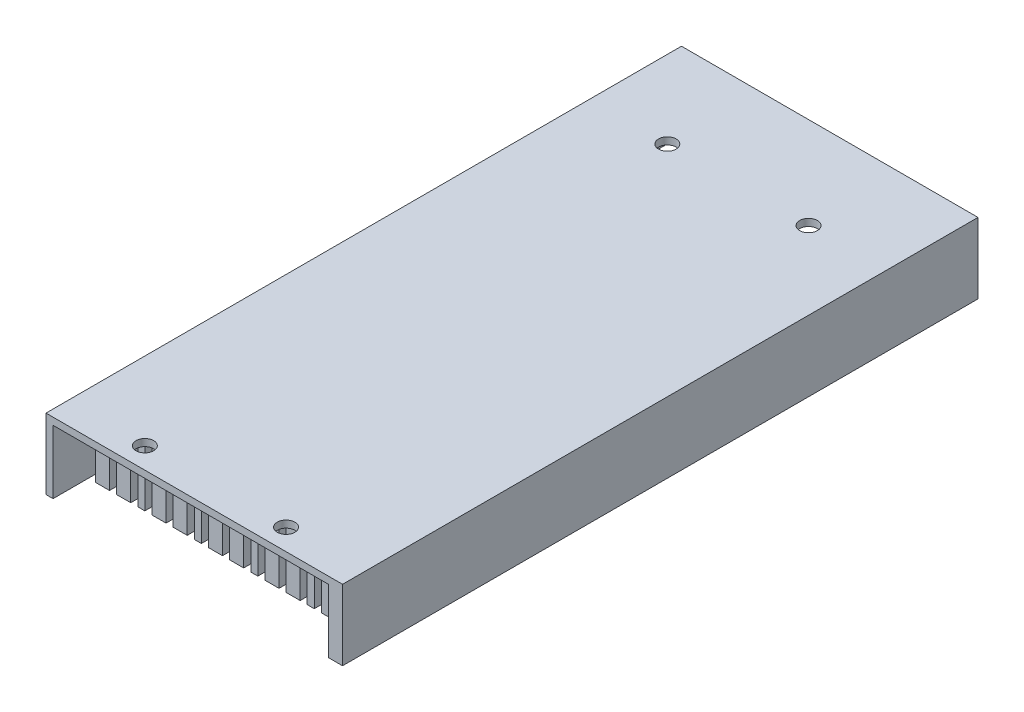
from build123d import *

# Parameters (mm, degrees)
BOSS_EXTRU_1_DEPTH      = 90
ESQUISSE3_W             = 39
ESQUISSE3_H             = 9
ENL_V_MAT_EXTRU_1_DEPTH = 5
ESQUISSE4_R             = 1.25
ENL_V_MAT_EXTRU_2_DEPTH = 5
ESQUISSE5_W             = 39
ESQUISSE5_H             = 9
ENL_V_MAT_EXTRU_3_DEPTH = 16


with BuildPart() as part:
    # Esquisse1 → Boss.-Extru.1 (new body)
    with BuildSketch(Plane.XY):
        Polygon((0, 0), (-2, 0), (-2, 9), (-3, 9), (-3, 0), (-5, 0), (-5, 9), (-6, 9), (-6, 0), (-8, 0), (-8, 9), (-9, 9), (-9, 0), (-10, 0), (-10, 9), (-11, 9), (-11, 0), (-13, 0), (-13, 9), (-14, 9), (-14, 0), (-16, 0), (-16, 9), (-17, 9), (-17, 0), (-18, 0), (-18, 9), (-19, 9), (-19, 0), (-21, 0), (-21, 9), (-22, 9), (-22, 0), (-24, 0), (-24, 9), (-25, 9), (-25, 0), (-26, 0), (-26, 9), (-27, 9), (-27, 0), (-29, 0), (-29, 9), (-30, 9), (-30, 0), (-32, 0), (-32, 9), (-33, 9), (-33, 0), (-34, 0), (-34, 9), (-35, 9), (-35, 0), (-37, 0), (-37, 9), (-38, 9), (-38, 0), (-40, 0), (-40, 9), (-41, 9), (-41, 0), (-42, 0), (-42, 10), (0, 10), align=None)
    extrude(amount=BOSS_EXTRU_1_DEPTH)

    # Esquisse3 → Enlèv. mat.-Extru.1 (cut)
    with BuildSketch(Plane.XY.offset(90)):
        with Locations((-21.5, 4.5)):
            Rectangle(ESQUISSE3_W, ESQUISSE3_H)
    extrude(amount=-ENL_V_MAT_EXTRU_1_DEPTH, mode=Mode.SUBTRACT)

    # Esquisse4 → Enlèv. mat.-Extru.2 (cut)
    with BuildSketch(Plane(origin=(0, 10, 0), x_dir=(1, 0, 0), z_dir=(0, 1, 0))):
        with Locations(Location((-31, -87, 0), (0, 0, 270))):
            Circle(ESQUISSE4_R)
        with Locations(Location((-11, -87, 0), (0, 0, 270))):
            Circle(ESQUISSE4_R)
        with Locations(Location((-11, -13, 0), (0, 0, 90))):
            Circle(ESQUISSE4_R)
        with Locations(Location((-31, -13, 0), (0, 0, 323.130102354))):
            Circle(ESQUISSE4_R)
    extrude(amount=-ENL_V_MAT_EXTRU_2_DEPTH, mode=Mode.SUBTRACT)

    # Esquisse5 → Enlèv. mat.-Extru.3 (cut)
    with BuildSketch(Plane(origin=(0, 0, 0), x_dir=(-1, 0, 0), z_dir=(0, 0, -1))):
        with Locations((21.5, 4.5)):
            Rectangle(ESQUISSE5_W, ESQUISSE5_H)
    extrude(amount=-ENL_V_MAT_EXTRU_3_DEPTH, mode=Mode.SUBTRACT)


solid = part.part
